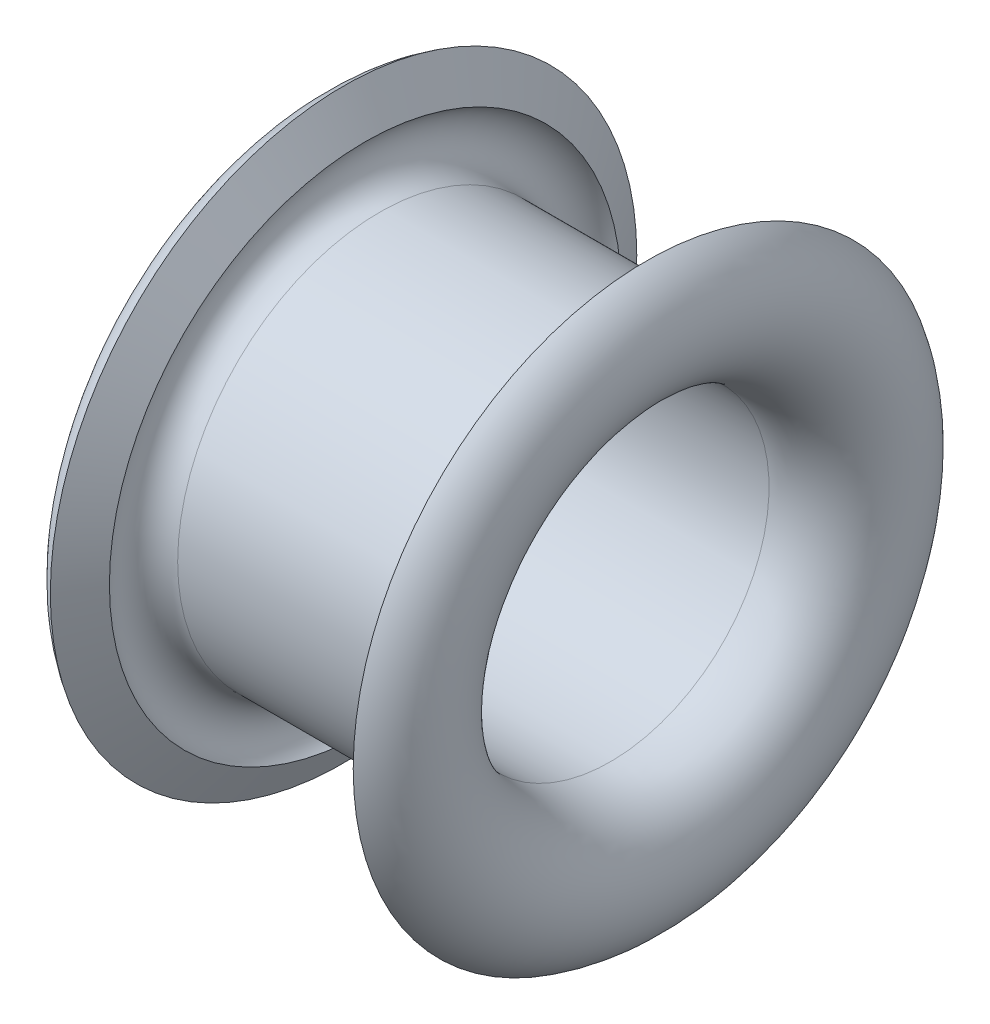
from build123d import *


with BuildPart() as part:
    # Эскиз1 → Повернуть1 (revolve)
    with BuildSketch(Plane.XY, mode=Mode.PRIVATE) as revolve_1_sk:
        with BuildLine():
            Line((0, 1.1), (0.8, 1.1))
            ThreePointArc((0.8, 1.1), (1.282962913, 1.470590477), (1.05, 2.033012702))
            Line((1.05, 2.033012702), (0.9, 1.773205081))
            ThreePointArc((0.9, 1.773205081), (0.993185165, 1.548236191), (0.8, 1.4))
            Line((0.8, 1.4), (0, 1.4))
            Line((0, 1.4), (0, 1.1))
        make_face()
    revolve_1 = revolve(revolve_1_sk.sketch.rotate(Axis((0, 0, 0), (1, 0, 0)), 90), axis=Axis((0, 0, 0), (1, 0, 0)))

    # Зеркальное отражение1: Повернуть1 across plane
    add(revolve_1.mirror(Plane(origin=(0, 1.1, 0), x_dir=(0, 0, 1), z_dir=(1, 0, 0))))


solid = part.part
